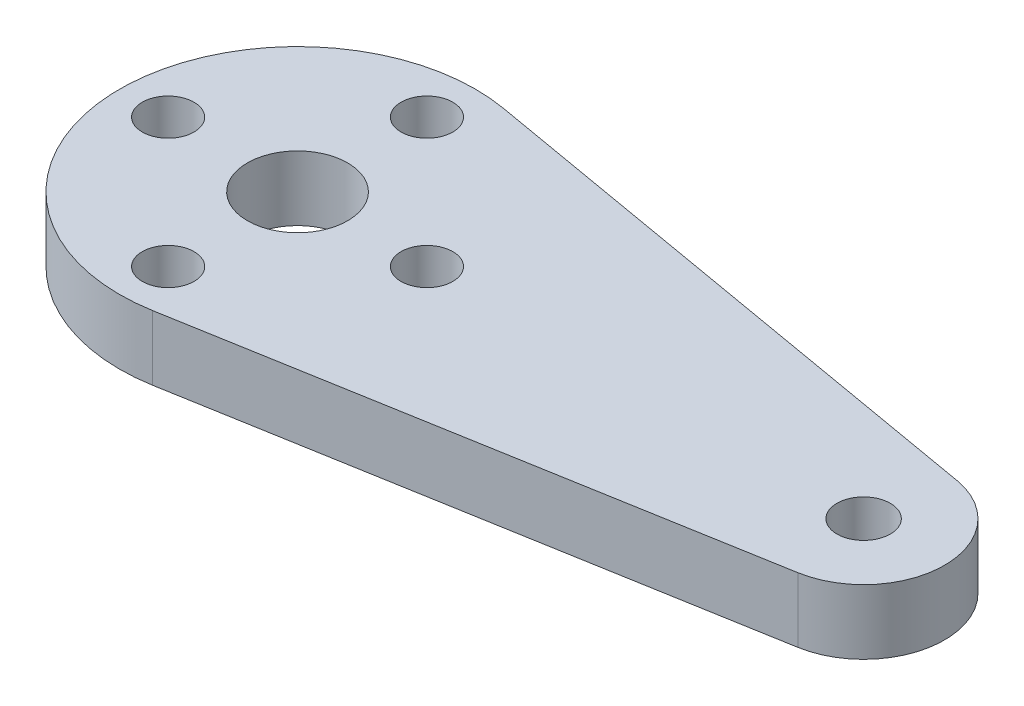
from build123d import *

# Parameters (mm, degrees)
EXTRUDE_1_DEPTH     = 4
SKETCH_3_R          = 3.1
SKETCH_3_R_2        = 1.6
SKETCH_3_R_3        = 1.65
CUT_EXTRUDE_1_DEPTH = 4


with BuildPart() as part:
    # 草图1 → 凸台-拉伸1 (new body)
    with BuildSketch(Plane(origin=(0, 0, 0), x_dir=(1, 0, 0), z_dir=(0, 1, 0))):
        with BuildLine():
            Line((20.495765525, 4.925982785), (-13.475662945, 10.837162075))
            ThreePointArc((-13.475662945, 10.837162075), (-26.361377172, 4.5e-08), (-13.475663034, -10.837162091))
            Line((-13.475663034, -10.837162091), (20.495765576, -4.925982776))
            ThreePointArc((20.495765576, -4.925982776), (24.638622828, 2.6e-08), (20.495765525, 4.925982785))
        make_face()
    extrude(amount=EXTRUDE_1_DEPTH)

    # 草图3 → 切除-拉伸1 (cut)
    with BuildSketch(Plane(origin=(0, 4, 0), x_dir=(1, 0, 0), z_dir=(0, 1, 0))):
        with Locations(Location((-15.36137507, 8.881e-05, 0), (0, 0, 270))):
            Circle(SKETCH_3_R)
        with Locations(Location((-23.36137507, 8.881e-05, 0), (0, 0, 270))):
            Circle(SKETCH_3_R_2)
        with Locations(Location((-15.36137507, 8.00008881, 0), (0, 0, 270))):
            Circle(SKETCH_3_R_2)
        with Locations(Location((-7.36137507, 8.881e-05, 0), (0, 0, 270))):
            Circle(SKETCH_3_R_2)
        with Locations(Location((-15.36137507, -7.99991119, 0), (0, 0, 270))):
            Circle(SKETCH_3_R_2)
        with Locations(Location((19.638622828, 0, 0), (0, 0, 270))):
            Circle(SKETCH_3_R_3)
    extrude(amount=-CUT_EXTRUDE_1_DEPTH, mode=Mode.SUBTRACT)


solid = part.part
